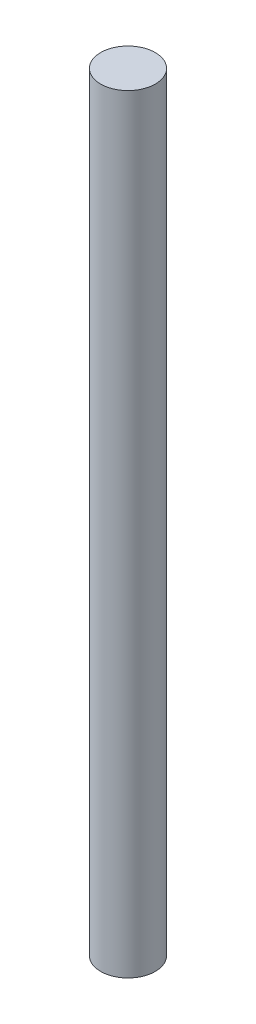
from build123d import *

# Parameters (mm, degrees)
SKETCH2_R           = 0.5
BOSS_EXTRUDE1_DEPTH = 14.07


with BuildPart() as part:
    # Sketch2 → Boss-Extrude1 (new body)
    with BuildSketch(Plane(origin=(0, 0, 0), x_dir=(1, 0, 0), z_dir=(0, 1, 0))):
        with Locations(Location((0, 0, 0), (0, 0, 270))):
            Circle(SKETCH2_R)
    extrude(amount=BOSS_EXTRUDE1_DEPTH)


solid = part.part
